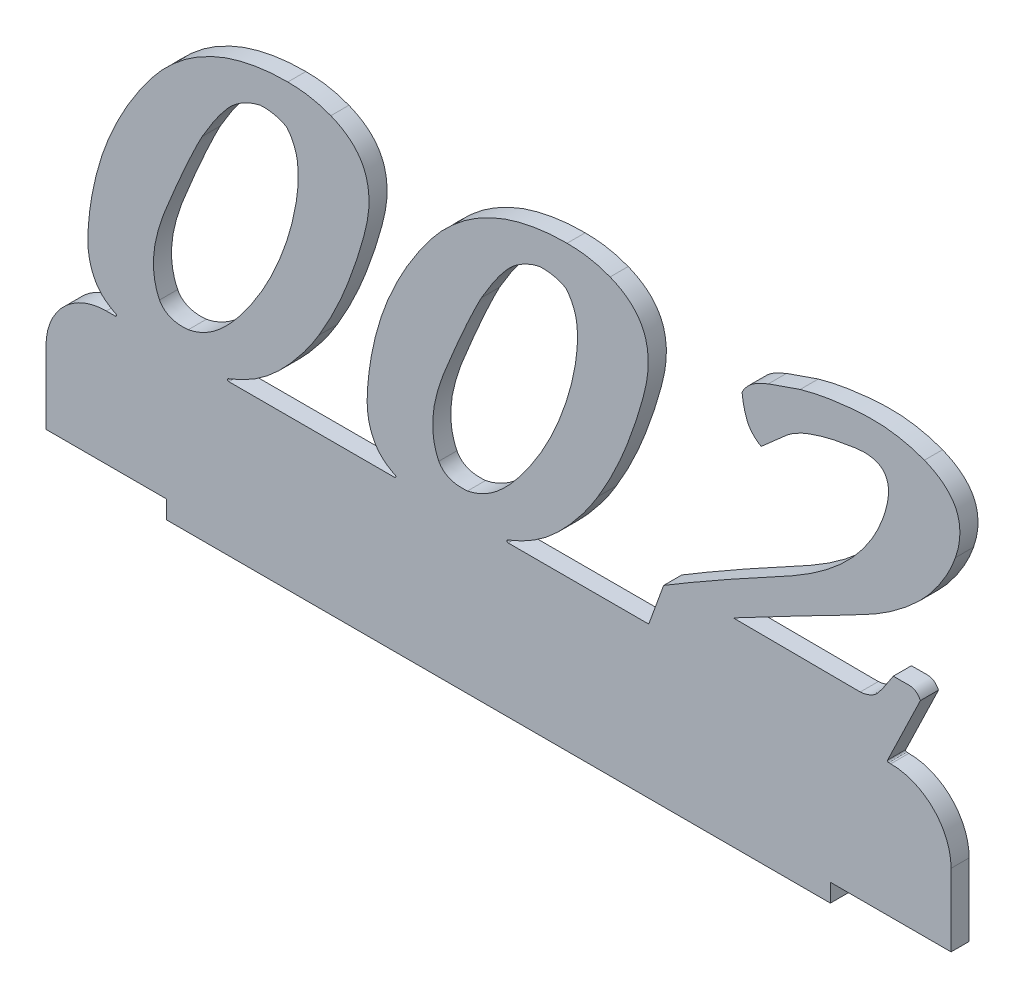
from build123d import *

# Parameters (mm, degrees)
BOSS_EXTRUDE1_DEPTH = 3
FILLET1_R           = 10
FILLET2_R           = 0.2


with BuildPart() as part:
    # Sketch1 → Boss-Extrude1 (new body)
    with BuildSketch(Plane.XY):
        with BuildLine():
            Line((139.349953687, 22.00000098), (150, 22.000001602))
            Line((150, 22.000001602), (150, 0))
            Line((150, 0), (130, 0))
            Line((130, 0), (130, -3))
            Line((130, -3), (20, -3))
            Line((20, -3), (20, 0))
            Line((20, 0), (0, 0))
            Line((0, 0), (0, 22.000000414))
            Line((0, 22.000000414), (12.611832202, 22.000000414))
            add(Edge.make_bspline(
                [(12.611832202, 22.000000414), (12.148747805, 22.148710262), (11.211394507, 22.492999894), (9.95523942, 23.310181233), (8.845276423, 24.329241776), (8.015403016, 25.606512623), (7.409920763, 27.078042824), (6.856296356, 29.442885006), (6.925928587, 31.362591581), (7.016270854, 32.677124846)],
                knots=[0.508043588, 0.508043588, 0.508043588, 0.508043588, 0.562299825, 0.61931963, 0.674487907, 0.729675441, 0.788153341, 0.851799168, 1, 1, 1, 1], degree=3))
            add(Edge.make_bspline(
                [(7.016270854, 32.677124846), (7.18319492, 34.905221254), (7.67238779, 38.230794879), (8.801774263, 42.567598998), (9.864606658, 45.776962379), (11.219230101, 48.910299896), (12.757228325, 52.016129122), (14.564964854, 55.059278063), (16.57204993, 58.026412086), (18.769588366, 60.815760782), (21.243843172, 63.234574583), (23.886107606, 65.32220627), (26.766327861, 66.969597064), (29.801827856, 68.317438754), (34.224235533, 69.539767489), (37.702954389, 69.924481769), (40.06943739, 69.893700296)],
                knots=[0, 0, 0, 0, 0.122246067, 0.183381441, 0.245050885, 0.307031795, 0.37001055, 0.434578783, 0.500534692, 0.565957523, 0.628479512, 0.689453544, 0.749684058, 0.80955899, 0.870724503, 1, 1, 1, 1], degree=3))
            add(Edge.make_bspline(
                [(40.06943739, 69.893700296), (41.329676845, 69.883250442), (43.772516127, 69.739734511), (46.11267005, 69.029878716), (47.203917453, 68.623176449)],
                knots=[0, 0, 0, 0, 0.519885394, 1, 1, 1, 1], degree=3))
            add(Edge.make_bspline(
                [(47.203917453, 68.623176449), (48.471464867, 68.107878237), (50.266517524, 67.114528265), (52.005830191, 65.131616246), (52.915352283, 63.458142126), (53.430634865, 61.553223312), (53.595945839, 59.43617795), (53.402838402, 57.105409406), (52.653438137, 53.766001863), (51.37491779, 49.599573778), (49.07373418, 43.295994264), (46.876817997, 38.869716873), (45.210172339, 36.117312493)],
                knots=[0, 0, 0, 0, 0.111905612, 0.162582178, 0.212592743, 0.265416324, 0.321765959, 0.384451445, 0.45478123, 0.599580751, 0.738515281, 1, 1, 1, 1], degree=3))
            add(Edge.make_bspline(
                [(45.210172339, 36.117312493), (44.118688221, 34.26010021), (42.248390788, 31.689625723), (39.499039408, 28.566642613), (37.330344512, 26.497374779), (34.947912834, 24.689712326), (32.268189037, 23.193918203), (30.283731253, 22.387219312), (29.215249279, 22.020924889), (29.153573094, 22.000000414)],
                knots=[0, 0, 0, 0, 0.257859597, 0.380113614, 0.498337489, 0.61657684, 0.737567111, 0.865047578, 0.872847897, 0.872847897, 0.872847897, 0.872847897], degree=3))
            Line((29.153573094, 22.000000414), (58.897993272, 22.000000414))
            add(Edge.make_bspline(
                [(58.897993272, 22.000000414), (58.434908873, 22.148710262), (57.497555573, 22.492999892), (56.241400483, 23.310181234), (55.131437487, 24.329241776), (54.30156408, 25.606512623), (53.696081827, 27.078042824), (53.14245742, 29.442885006), (53.21208965, 31.362591581), (53.302431917, 32.677124846)],
                knots=[0.508043588, 0.508043588, 0.508043588, 0.508043588, 0.562299825, 0.61931963, 0.674487907, 0.729675441, 0.788153341, 0.851799168, 1, 1, 1, 1], degree=3))
            add(Edge.make_bspline(
                [(53.302431917, 32.677124846), (53.469355983, 34.905221254), (53.958548853, 38.230794879), (55.087935326, 42.567598998), (56.150767721, 45.776962379), (57.505391164, 48.910299896), (59.043389388, 52.016129122), (60.851125917, 55.059278063), (62.858210993, 58.026412086), (65.055749429, 60.815760782), (67.530004236, 63.234574583), (70.172268669, 65.32220627), (73.052488924, 66.969597064), (76.08798892, 68.317438754), (80.510396597, 69.539767489), (83.989115452, 69.924481769), (86.355598454, 69.893700296)],
                knots=[0, 0, 0, 0, 0.122246067, 0.183381441, 0.245050885, 0.307031795, 0.37001055, 0.434578783, 0.500534692, 0.565957523, 0.628479512, 0.689453544, 0.749684058, 0.80955899, 0.870724503, 1, 1, 1, 1], degree=3))
            add(Edge.make_bspline(
                [(86.355598454, 69.893700296), (87.615837909, 69.883250442), (90.05867719, 69.739734511), (92.398831114, 69.029878716), (93.490078516, 68.623176449)],
                knots=[0, 0, 0, 0, 0.519885394, 1, 1, 1, 1], degree=3))
            add(Edge.make_bspline(
                [(93.490078516, 68.623176449), (94.75762593, 68.107878237), (96.552678588, 67.114528265), (98.291991254, 65.131616246), (99.201513346, 63.458142126), (99.716795928, 61.553223312), (99.882106903, 59.43617795), (99.688999465, 57.105409406), (98.9395992, 53.766001863), (97.661078854, 49.599573778), (95.359895243, 43.295994264), (93.16297906, 38.869716873), (91.496333403, 36.117312493)],
                knots=[0, 0, 0, 0, 0.111905612, 0.162582178, 0.212592743, 0.265416324, 0.321765959, 0.384451445, 0.45478123, 0.599580751, 0.738515281, 1, 1, 1, 1], degree=3))
            add(Edge.make_bspline(
                [(91.496333403, 36.117312493), (90.404849284, 34.26010021), (88.534551851, 31.689625723), (85.785200472, 28.566642613), (83.616505575, 26.497374779), (81.234073897, 24.689712326), (78.5543501, 23.193918203), (76.569892316, 22.387219312), (75.501410342, 22.020924889), (75.439734157, 22.000000414)],
                knots=[0, 0, 0, 0, 0.257859597, 0.380113614, 0.498337489, 0.61657684, 0.737567111, 0.865047578, 0.872847897, 0.872847897, 0.872847897, 0.872847897], degree=3))
            Line((75.439734157, 22.000000414), (99.894402375, 22.000000414))
            Line((99.894402375, 22.000000414), (102.364198923, 28.787367223))
            add(Edge.make_bspline(
                [(102.364198923, 28.787367223), (103.773264372, 29.635764363), (105.956458762, 30.947641806), (108.998859399, 32.680378388), (111.469400334, 34.115086469), (114.095333449, 35.576004986), (116.860874206, 37.101655038), (119.755874275, 38.711766031), (122.779557321, 40.300634629), (125.7245595, 41.987944994), (128.431116844, 43.815394346), (130.872576773, 45.70282727), (133.015191361, 47.708452995), (134.881966543, 49.796556227), (136.952748682, 52.671563322), (138.155344431, 54.999765511), (138.720727461, 56.621612727)],
                knots=[0, 0, 0, 0, 0.105524725, 0.163385995, 0.224617296, 0.288806203, 0.356161699, 0.427252852, 0.501313646, 0.575301268, 0.644861957, 0.710669145, 0.773069231, 0.832880115, 0.890073183, 1, 1, 1, 1], degree=3))
            add(Edge.make_bspline(
                [(138.720727461, 56.621612727), (139.150392096, 57.857097249), (139.679649068, 59.605763162), (139.630329468, 61.827613139), (139.191019077, 63.029509486), (138.373480948, 63.929229001), (137.160129834, 64.401197968), (135.661039029, 64.582351174), (133.920876437, 64.393865713), (132.102894293, 64.084064304), (130.337476401, 63.745135121), (128.728997371, 63.328472163), (127.261207067, 62.880062768), (125.927133363, 62.404502013), (124.421448386, 61.69303414), (123.39067746, 61.086309952), (122.809859595, 60.589556433)],
                knots=[0, 0, 0, 0, 0.163533838, 0.22358703, 0.273097817, 0.319542769, 0.369979931, 0.431293779, 0.506061157, 0.586526579, 0.660902098, 0.729494961, 0.793064576, 0.851774175, 0.90542867, 1, 1, 1, 1], degree=3))
            Line((122.809859595, 60.589556433), (118.529171558, 56.817077935))
            add(Edge.make_bspline(
                [(118.529171558, 56.817077935), (117.998288155, 57.116929907), (117.07251925, 57.842226448), (116.426538796, 58.82548217), (116.222682113, 59.338579107)],
                knots=[0, 0, 0, 0, 0.525688222, 1, 1, 1, 1], degree=3))
            add(Edge.make_bspline(
                [(116.222682113, 59.338579107), (115.513569797, 61.119618077), (115.362635201, 63.032871523)],
                knots=[0, 0, 0, 1, 1, 1], degree=2))
            add(Edge.make_bspline(
                [(115.362635201, 63.032871523), (115.741157007, 63.794773876), (117.007420328, 65.251662103), (118.77323807, 66.015554536), (119.721509321, 66.394873087)],
                knots=[0, 0, 0, 0, 0.451020123, 1, 1, 1, 1], degree=3))
            add(Edge.make_bspline(
                [(119.721509321, 66.394873087), (122.341555173, 67.367208211), (124.999069916, 68.232246035)],
                knots=[0, 0, 0, 1, 1, 1], degree=2))
            add(Edge.make_bspline(
                [(124.999069916, 68.232246035), (126.62227281, 68.699805312), (129.141291099, 69.218765027), (132.588376242, 69.687786529), (135.275954227, 69.896423194), (137.977271292, 69.971949367), (141.46309773, 69.617496629), (143.99003896, 68.996066795), (145.581556233, 68.36907168)],
                knots=[0, 0, 0, 0, 0.242040332, 0.368376016, 0.498665213, 0.628561786, 0.755290793, 1, 1, 1, 1], degree=3))
            add(Edge.make_bspline(
                [(145.581556233, 68.36907168), (146.758868232, 67.890556333), (148.407086132, 67.014190136), (150.068623031, 65.319963312), (150.921376577, 63.941474589), (151.392948401, 62.387777586), (151.570159579, 60.004694864), (151.1540207, 58.16731848), (150.722291182, 56.95390358)],
                knots=[0, 0, 0, 0, 0.269969076, 0.3868787, 0.498157891, 0.609266408, 0.726758964, 1, 1, 1, 1], degree=3))
            add(Edge.make_bspline(
                [(150.722291182, 56.95390358), (150.152454909, 55.295443047), (148.92634985, 52.934504641), (146.854655977, 50.022740837), (145.002979977, 47.935994575), (142.854040547, 45.991187638), (140.463519954, 44.124909361), (137.794978187, 42.380661301), (133.921972853, 40.295542895), (129.112279502, 37.872300254), (122.128617224, 34.214892134), (117.098884164, 31.61389554), (113.916192668, 29.901518904)],
                knots=[0, 0, 0, 0, 0.112095574, 0.169586155, 0.228763596, 0.290550216, 0.355136688, 0.423026188, 0.494632822, 0.636984017, 0.768320184, 1, 1, 1, 1], degree=3))
            Line((113.916192668, 29.901518904), (134.948248962, 29.78423978))
            add(Edge.make_bspline(
                [(134.948248962, 29.78423978), (135.607150353, 29.842391409), (136.581084579, 30.066768065), (137.635515376, 30.811626816), (138.869042299, 32.298672523), (139.656836956, 33.718726198), (140.421274763, 34.788149084)],
                knots=[0, 0, 0, 0, 0.257232278, 0.374596102, 0.492310467, 1, 1, 1, 1], degree=3))
            add(Edge.make_bspline(
                [(140.421274763, 34.788149084), (141.273271805, 34.749838366), (142.311098897, 34.836745543), (143.565650502, 34.789828243), (144.335362605, 34.439092827), (144.721070442, 33.912750784), (144.916974529, 33.537171758)],
                knots=[0, 0, 0, 0, 0.506825366, 0.628241153, 0.743426283, 1, 1, 1, 1], degree=3))
            Line((144.916974529, 33.537171758), (139.349953687, 22.00000098))
        make_face()
        with BuildLine():
            add(Edge.make_bspline(
                [(39.932611745, 63.286976293), (39.331351779, 63.696493443), (37.866063473, 64.202637638), (36.328267433, 64.329932774), (35.515098063, 64.283848849)],
                knots=[0, 0, 0, 0, 0.469698931, 1, 1, 1, 1], degree=3))
            add(Edge.make_bspline(
                [(35.515098063, 64.283848849), (34.370396791, 64.043160347), (32.752357883, 63.365632042), (30.863970939, 61.988066293), (28.556064261, 59.410006018), (27.022366498, 56.95842197), (25.878663348, 54.979704987)],
                knots=[0, 0, 0, 0, 0.252589616, 0.375811021, 0.503770371, 1, 1, 1, 1], degree=3))
            add(Edge.make_bspline(
                [(25.878663348, 54.979704987), (25.422384532, 54.181649233), (24.824164718, 52.865083607), (23.932651557, 51.046021248), (23.219183896, 49.464473298), (22.454802372, 47.745244814), (21.654315068, 45.87851597), (20.797716269, 43.882307869), (19.925652252, 41.79398616), (19.13266376, 39.695810166), (18.501008052, 37.66845698), (18.060202512, 35.761363275), (17.817301027, 33.968319432), (17.769987199, 32.289034902), (17.97169137, 30.263335695), (18.391199376, 28.839678343), (18.822369368, 27.985959874)],
                knots=[0, 0, 0, 0, 0.095871325, 0.150956838, 0.211549603, 0.277044413, 0.347448488, 0.423659813, 0.503898773, 0.583776288, 0.6578152, 0.725493304, 0.78794858, 0.846481479, 0.900510454, 1, 1, 1, 1], degree=3))
            add(Edge.make_bspline(
                [(18.822369368, 27.985959874), (19.18081621, 27.242942856), (20.680290266, 26.035667373), (22.593191312, 26.019079122), (23.572173903, 26.089947364)],
                knots=[0, 0, 0, 0, 0.446153942, 1, 1, 1, 1], degree=3))
            add(Edge.make_bspline(
                [(23.572173903, 26.089947364), (25.029698401, 26.364302572), (27.18629367, 27.382723137), (29.718595187, 29.55049267), (31.669057137, 31.707685247), (33.535856175, 34.193204419), (35.297381941, 36.867206215), (36.887830079, 39.693692814), (38.282357998, 42.649940814), (39.480508166, 45.666925273), (40.472043145, 48.678987123), (41.190725035, 51.667483977), (41.695262243, 54.558087325), (41.864879063, 57.259842581), (41.663012928, 60.290405746), (40.788166316, 62.27895721), (39.932611745, 63.286976293)],
                knots=[0, 0, 0, 0, 0.099522769, 0.157975555, 0.224341199, 0.295661745, 0.367825167, 0.440561069, 0.514605516, 0.588508481, 0.659789613, 0.728660389, 0.796041852, 0.857776262, 0.9112652, 1, 1, 1, 1], degree=3))
        make_face(mode=Mode.SUBTRACT)
        with BuildLine():
            add(Edge.make_bspline(
                [(86.218772809, 63.286976293), (85.617512842, 63.696493443), (84.152224536, 64.202637638), (82.614428496, 64.329932774), (81.801259126, 64.283848849)],
                knots=[0, 0, 0, 0, 0.469698931, 1, 1, 1, 1], degree=3))
            add(Edge.make_bspline(
                [(81.801259126, 64.283848849), (80.656557854, 64.043160347), (79.038518946, 63.365632042), (77.150132002, 61.988066293), (74.842225324, 59.410006018), (73.308527561, 56.95842197), (72.164824411, 54.979704987)],
                knots=[0, 0, 0, 0, 0.252589616, 0.375811021, 0.503770371, 1, 1, 1, 1], degree=3))
            add(Edge.make_bspline(
                [(72.164824411, 54.979704987), (71.708545596, 54.181649233), (71.110325782, 52.865083607), (70.21881262, 51.046021248), (69.505344959, 49.464473298), (68.740963435, 47.745244814), (67.940476132, 45.87851597), (67.083877332, 43.882307869), (66.211813315, 41.79398616), (65.418824823, 39.695810166), (64.787169116, 37.66845698), (64.346363576, 35.761363275), (64.103462091, 33.968319432), (64.056148262, 32.289034902), (64.257852434, 30.263335695), (64.677360439, 28.839678343), (65.108530432, 27.985959874)],
                knots=[0, 0, 0, 0, 0.095871325, 0.150956838, 0.211549603, 0.277044413, 0.347448488, 0.423659813, 0.503898773, 0.583776288, 0.6578152, 0.725493304, 0.78794858, 0.846481479, 0.900510454, 1, 1, 1, 1], degree=3))
            add(Edge.make_bspline(
                [(65.108530432, 27.985959874), (65.466977273, 27.242942856), (66.966451329, 26.035667373), (68.879352376, 26.019079122), (69.858334966, 26.089947364)],
                knots=[0, 0, 0, 0, 0.446153942, 1, 1, 1, 1], degree=3))
            add(Edge.make_bspline(
                [(69.858334966, 26.089947364), (71.315859465, 26.364302572), (73.472454733, 27.382723137), (76.00475625, 29.55049267), (77.9552182, 31.707685247), (79.822017239, 34.193204419), (81.583543005, 36.867206215), (83.173991142, 39.693692814), (84.568519061, 42.649940814), (85.766669229, 45.666925273), (86.758204209, 48.678987123), (87.476886098, 51.667483977), (87.981423306, 54.558087325), (88.151040126, 57.259842581), (87.949173991, 60.290405746), (87.07432738, 62.27895721), (86.218772809, 63.286976293)],
                knots=[0, 0, 0, 0, 0.099522769, 0.157975555, 0.224341199, 0.295661745, 0.367825167, 0.440561069, 0.514605516, 0.588508481, 0.659789613, 0.728660389, 0.796041852, 0.857776262, 0.9112652, 1, 1, 1, 1], degree=3))
        make_face(mode=Mode.SUBTRACT)
    extrude(amount=BOSS_EXTRUDE1_DEPTH)

    # Fillet1
    fillet1_edges = [part.edges().sort_by_distance(p)[0] for p in [
        (150, 22.000001602, 1.5),
        (0, 22.000000414, 1.5),
    ]]
    fillet(fillet1_edges, radius=FILLET1_R)

    # Fillet2
    fillet2_edges = [part.edges().sort_by_distance(p)[0] for p in [
        (12.611832202, 22.000000414, 1.5),
        (58.897993272, 22.000000414, 1.5),
        (99.894402375, 22.000000414, 1.5),
        (139.349953687, 22.00000098, 1.5),
        (75.439734157, 22.000000414, 1.5),
        (29.153573094, 22.000000414, 1.5),
    ]]
    fillet(fillet2_edges, radius=FILLET2_R)


solid = part.part
